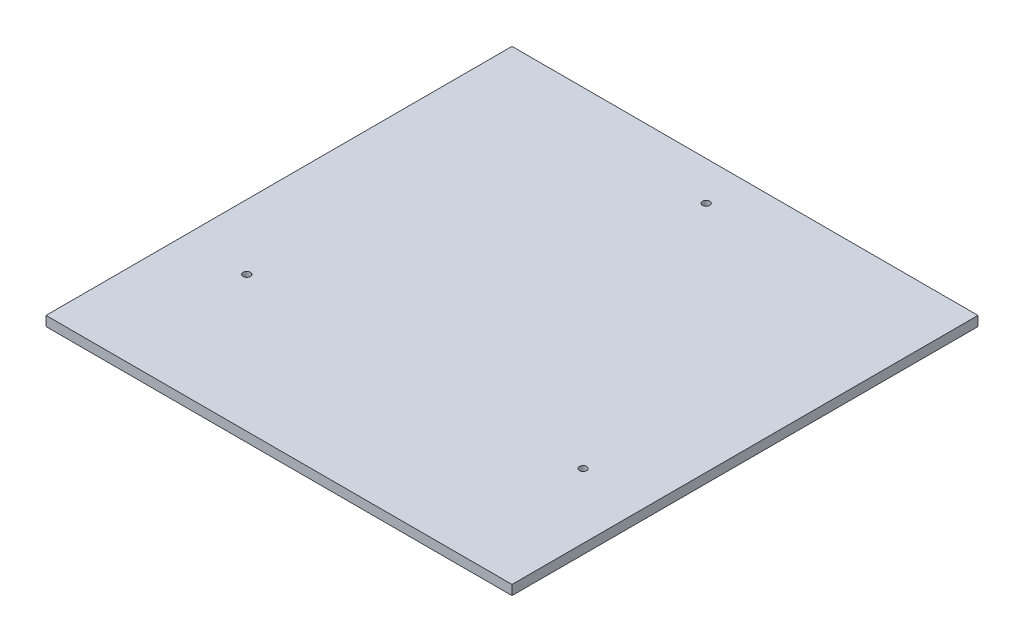
from build123d import *

# Parameters (mm, degrees)
SKETCH1_W           = 304.8
SKETCH1_H           = 304.8
BOSS_EXTRUDE1_DEPTH = 6.35
SKETCH2_R           = 2.38125
CUT_EXTRUDE1_DEPTH  = 6.35
CIRPATTERN1_COUNT   = 3


with BuildPart() as part:
    # Sketch1 → Boss-Extrude1 (new body)
    with BuildSketch(Plane(origin=(0, 0, 0), x_dir=(1, 0, 0), z_dir=(0, 1, 0))):
        with Locations((152.4, 152.4)):
            Rectangle(SKETCH1_W, SKETCH1_H)
    extrude(amount=BOSS_EXTRUDE1_DEPTH)

    # Sketch2 → Cut-Extrude1 (cut)
    with BuildSketch(Plane(origin=(0, 6.35, 0), x_dir=(1, 0, 0), z_dir=(0, 1, 0))):
        with Locations((152.4, 279.4)):
            Circle(SKETCH2_R)
    cut_extrude1 = extrude(amount=-CUT_EXTRUDE1_DEPTH, mode=Mode.SUBTRACT)

    # CirPattern1: Cut-Extrude1 ×3 about axis
    cirpattern1_axis = Axis((152.4, -0.3175, -152.4), (0, 1, 0))
    for i in range(1, CIRPATTERN1_COUNT):
        add(cut_extrude1.rotate(cirpattern1_axis, i * 360 / CIRPATTERN1_COUNT), mode=Mode.SUBTRACT)


solid = part.part
